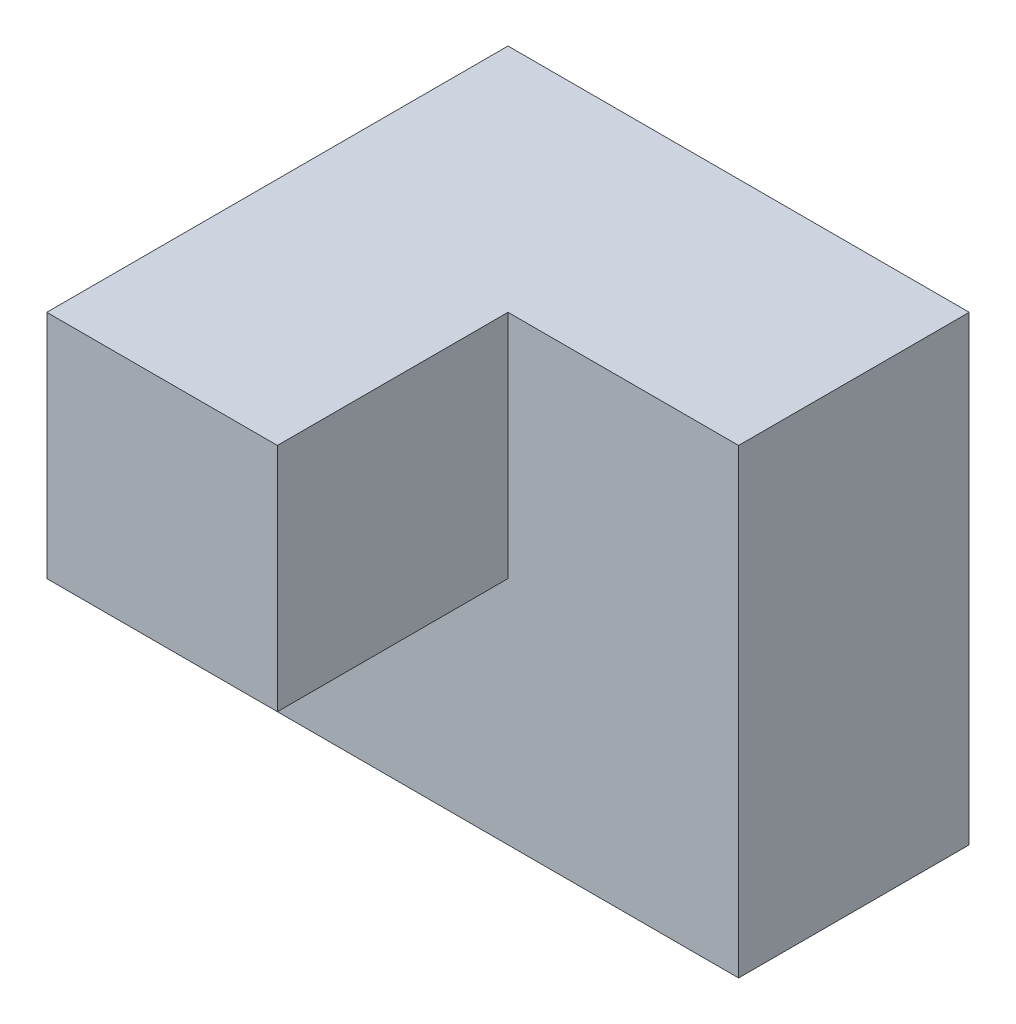
from build123d import *

# Parameters (mm, degrees)
SKETCH1_W           = 38.1
SKETCH1_H           = 38.1
BOSS_EXTRUDE1_DEPTH = 19.05
SKETCH2_W           = 19.05
SKETCH2_H           = 19.05
BOSS_EXTRUDE2_DEPTH = 19.05


with BuildPart() as part:
    # Sketch1 → Boss-Extrude1 (new body)
    with BuildSketch(Plane.XY):
        with Locations((19.05, -19.05)):
            Rectangle(SKETCH1_W, SKETCH1_H)
    extrude(amount=BOSS_EXTRUDE1_DEPTH)

    # Sketch2 → Boss-Extrude2 (add)
    with BuildSketch(Plane.XY.offset(19.05)):
        with Locations((9.525, -9.525)):
            Rectangle(SKETCH2_W, SKETCH2_H)
    extrude(amount=BOSS_EXTRUDE2_DEPTH)


solid = part.part
